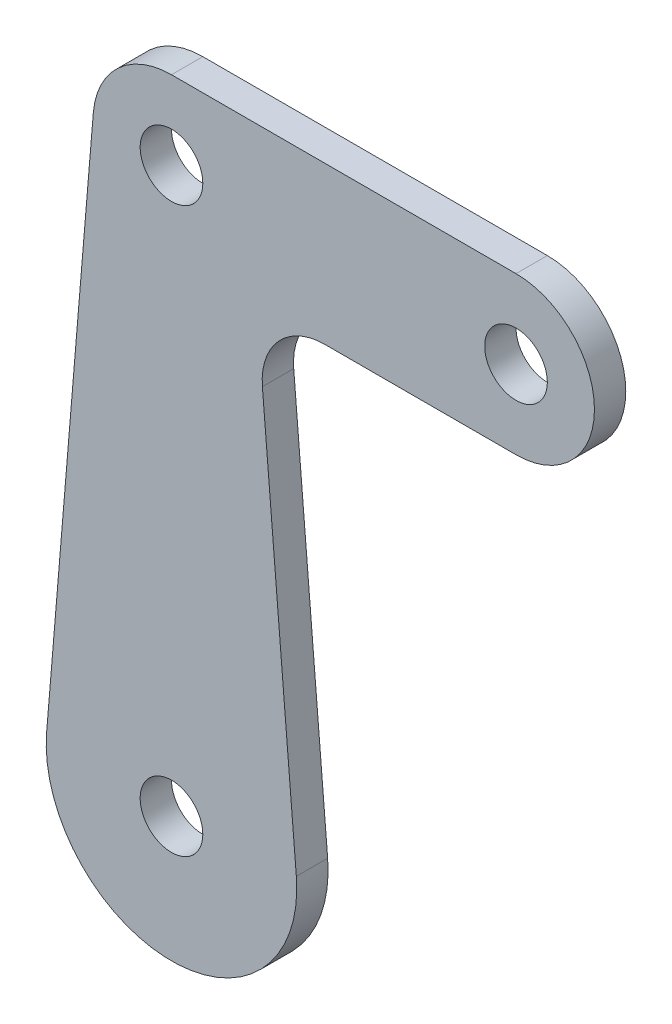
from build123d import *

# Parameters (mm, degrees)
SKETCH1_R           = 3.175
BOSS_EXTRUDE1_DEPTH = 3.175


with BuildPart() as part:
    # Sketch1 → Boss-Extrude1 (new body)
    with BuildSketch(Plane.XY):
        with BuildLine():
            Line((-12.656061642, -56.094488889), (-7.922694588, 0.660749956))
            ThreePointArc((-7.922694588, 0.660749956), (-5.382963205, 5.850588617), (0, 7.9502))
            Line((0, 7.9502), (34.925, 7.9502))
            ThreePointArc((34.925, 7.9502), (42.8752, 0), (34.925, -7.9502))
            Line((34.925, -7.9502), (15.542478028, -7.9502))
            ThreePointArc((15.542478028, -7.9502), (10.869483924, -10.000708622), (9.214447206, -14.827955556))
            Line((9.214447206, -14.827955556), (12.656061642, -56.094488889))
            ThreePointArc((12.656061642, -56.094488889), (0, -69.85), (-12.656061642, -56.094488889))
        make_face()
        with Locations((0, -57.15)):
            Circle(SKETCH1_R, mode=Mode.SUBTRACT)
        Circle(SKETCH1_R, mode=Mode.SUBTRACT)
        with Locations((34.925, 0)):
            Circle(SKETCH1_R, mode=Mode.SUBTRACT)
    extrude(amount=BOSS_EXTRUDE1_DEPTH)


solid = part.part
